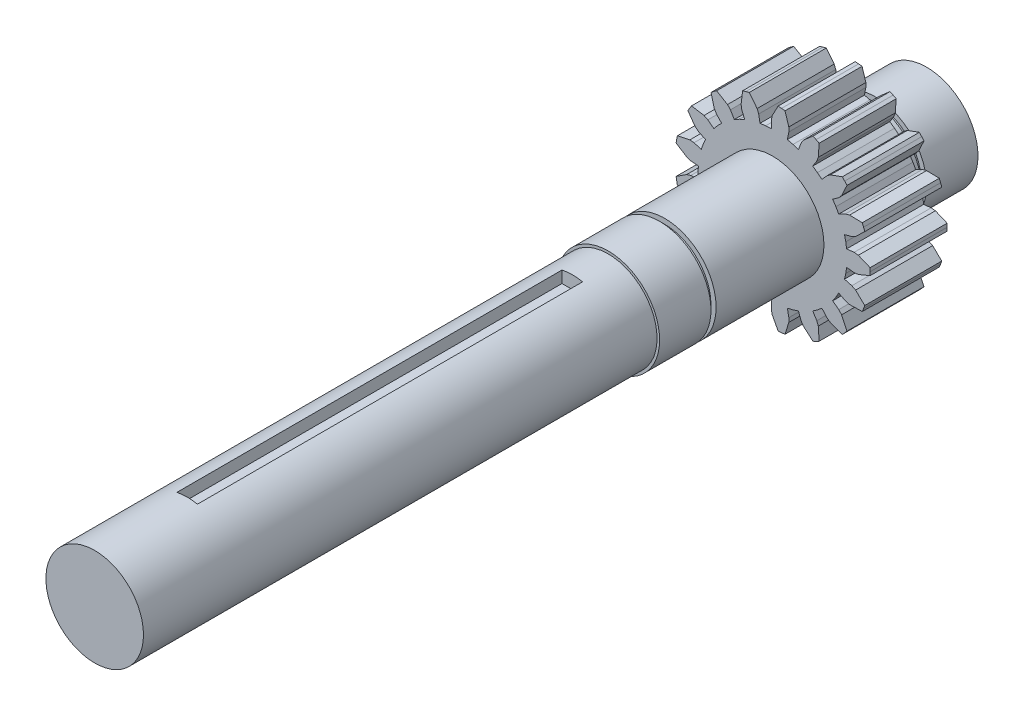
from build123d import *

# Parameters (mm, degrees)
GEAR_A_17T_INVOLUTE_DEPTH = 15
SKETCH2_R                 = 10
LEFT_STUB_D20X15_DEPTH    = 15
RIGHT_SHAFT_D20X32_START  = 32
SKETCH3_R                 = 10
RIGHT_SHAFT_D20X32_DEPTH  = 32
SKETCH4_R                 = 9.5
INPUT_SHAFT_D19X100_DEPTH = 100
SKETCH5_W                 = 75
SKETCH5_H                 = 4
KEYWAY_SLOT_75X4MM_DEPTH  = 2
SKETCH6_W                 = 1
SKETCH6_H                 = 2
SKETCH7_W                 = 1
SKETCH7_H                 = 2


with BuildPart() as part:
    # Sketch1 → Gear_A_17T_Involute (new body)
    with BuildSketch(Plane.XY):
        Polygon((14.41660223, -1.552926312), (15.882894514, -1.710872257), (16.703678506, -1.62240281), (18.988043831, -0.673937289), (19, 0), (18.988043831, 0.673937289), (16.703678506, 1.62240281), (15.882894514, 1.710872257), (14.41660223, 1.552926312), (14.253109945, 2.664368008), (14.004062911, 3.759816751), (15.428396402, 4.142222411), (16.16179583, 4.52121909), (17.949277792, 6.230844785), (17.716972359, 6.863591658), (17.462369334, 7.487700397), (14.989636842, 7.54691022), (14.192319712, 7.332904146), (12.882099534, 6.65593807), (12.328148468, 7.633266362), (11.700197295, 8.564775727), (12.890207864, 9.435886989), (13.437173072, 10.054225299), (14.486362327, 12.294116744), (14.041169427, 12.800217229), (13.578305096, 13.290208076), (11.251161661, 12.452165587), (10.584993491, 11.964586697), (9.607797913, 10.860028511), (8.738202227, 11.571249796), (7.816155202, 12.213014282), (8.611125326, 13.455182743), (8.897785632, 14.229352669), (9.066983358, 16.697000113), (8.46902876, 17.008102536), (7.860415515, 17.297799511), (5.993154754, 15.67568699), (5.548105245, 14.980385516), (5.035909946, 13.597411924), (3.968113356, 13.946471826), (2.876498039, 14.211817584), (3.169062598, 15.65728151), (3.156702938, 16.482727113), (2.423058045, 18.844861096), (1.75309883, 18.91894935), (1.080933263, 18.969227272), (-0.074260913, 16.782120004), (-0.238085357, 15.973000263), (-0.216105565, 14.49838951), (-1.337891212, 14.438145556), (-2.451646125, 14.29123617), (-2.700999595, 15.744777649), (-3.010709979, 16.510017927), (-4.548114684, 18.447619164), (-5.199596811, 18.27468722), (-5.844535016, 18.078755777), (-6.131647231, 15.622034719), (-5.992121213, 14.808372814), (-5.438934822, 13.441279255), (-6.463206159, 12.979867725), (-7.448681894, 12.440544122), (-8.206276826, 13.705854322), (-8.771509831, 14.307539335), (-10.905039323, 15.558924042), (-11.450058091, 15.162327318), (-11.980666456, 14.746648137), (-11.360920615, 12.35210708), (-10.936887895, 11.643792561), (-9.927205792, 10.568849756), (-10.7156293, 9.768586833), (-11.439731898, 8.909687654), (-12.603250898, 9.815879422), (-13.347668676, 10.172748274), (-15.789177975, 10.568910014), (-16.154125579, 10.002211095), (-16.498742504, 9.422923952), (-15.055838716, 7.413958934), (-14.404567264, 6.906653602), (-13.074752612, 6.269038533), (-13.520847326, 5.23800416), (-13.88578272, 4.175528498), (-15.2980861, 4.600215614), (-16.121150904, 4.66407119), (-18.54090065, 4.151506124), (-18.676488894, 3.491240839), (-18.788571953, 2.826581673), (-16.717382372, 1.474514552), (-15.926830005, 1.236732803), (-14.456481642, 1.122558918), (-14.5, 0), (-14.456481642, -1.122558918), (-15.926830005, -1.236732803), (-16.717382372, -1.474514552), (-18.788571953, -2.826581673), (-18.676488894, -3.491240839), (-18.54090065, -4.151506124), (-16.121150904, -4.66407119), (-15.2980861, -4.600215614), (-13.88578272, -4.175528498), (-13.520847326, -5.23800416), (-13.074752612, -6.269038533), (-14.404567264, -6.906653602), (-15.055838716, -7.413958934), (-16.498742504, -9.422923952), (-16.154125579, -10.002211095), (-15.789177975, -10.568910014), (-13.347668676, -10.172748274), (-12.603250898, -9.815879422), (-11.439731898, -8.909687654), (-10.7156293, -9.768586833), (-9.927205792, -10.568849756), (-10.936887895, -11.643792561), (-11.360920615, -12.35210708), (-11.980666456, -14.746648137), (-11.450058091, -15.162327318), (-10.905039323, -15.558924042), (-8.771509831, -14.307539335), (-8.206276826, -13.705854322), (-7.448681894, -12.440544122), (-6.463206159, -12.979867725), (-5.438934822, -13.441279255), (-5.992121213, -14.808372814), (-6.131647231, -15.622034719), (-5.844535016, -18.078755777), (-5.199596811, -18.27468722), (-4.548114684, -18.447619164), (-3.010709979, -16.510017927), (-2.700999595, -15.744777649), (-2.451646125, -14.29123617), (-1.337891212, -14.438145556), (-0.216105565, -14.49838951), (-0.238085357, -15.973000263), (-0.074260913, -16.782120004), (1.080933263, -18.969227272), (1.75309883, -18.91894935), (2.423058045, -18.844861096), (3.156702938, -16.482727113), (3.169062598, -15.65728151), (2.876498039, -14.211817584), (3.968113356, -13.946471826), (5.035909946, -13.597411924), (5.548105245, -14.980385516), (5.993154754, -15.67568699), (7.860415515, -17.297799511), (8.46902876, -17.008102536), (9.066983358, -16.697000113), (8.897785632, -14.229352669), (8.611125326, -13.455182743), (7.816155202, -12.213014282), (8.738202227, -11.571249796), (9.607797913, -10.860028511), (10.584993491, -11.964586697), (11.251161661, -12.452165587), (13.578305096, -13.290208076), (14.041169427, -12.800217229), (14.486362327, -12.294116744), (13.437173072, -10.054225299), (12.890207864, -9.435886989), (11.700197295, -8.564775727), (12.328148468, -7.633266362), (12.882099534, -6.65593807), (14.192319712, -7.332904146), (14.989636842, -7.54691022), (17.462369334, -7.487700397), (17.716972359, -6.863591658), (17.949277792, -6.230844785), (16.16179583, -4.52121909), (15.428396402, -4.142222411), (14.004062911, -3.759816751), (14.253109945, -2.664368008), align=None)
    extrude(amount=GEAR_A_17T_INVOLUTE_DEPTH)

    # Sketch2 → Left_Stub_D20x15 (add)
    with BuildSketch(Plane.XY):
        Circle(SKETCH2_R)
    extrude(amount=-LEFT_STUB_D20X15_DEPTH)

    # Sketch3 → Right_Shaft_D20x32 (add)
    with BuildSketch(Plane.XY.offset(15).offset(RIGHT_SHAFT_D20X32_START)):
        Circle(SKETCH3_R)
    extrude(amount=-RIGHT_SHAFT_D20X32_DEPTH)

    # Sketch4 → Input_Shaft_D19x100 (add)
    with BuildSketch(Plane.XY.offset(47)):
        Circle(SKETCH4_R)
    extrude(amount=INPUT_SHAFT_D19X100_DEPTH)

    # Sketch5 → Keyway_Slot_75x4mm (cut, symmetric)
    with BuildSketch(Plane(origin=(0, 0, 0), x_dir=(0, 0, -1), z_dir=(1, 0, 0))):
        with Locations((-91.5, 9)):
            Rectangle(SKETCH5_W, SKETCH5_H)
    extrude(amount=KEYWAY_SLOT_75X4MM_DEPTH, both=True, mode=Mode.SUBTRACT)

    # Sketch6 → Left_SnapRing_Groove_D18 (revolve, cut)
    with BuildSketch(Plane(origin=(0, 0, 0), x_dir=(0, 0, -1), z_dir=(1, 0, 0)), mode=Mode.PRIVATE) as left_snapring_groove_d18_sk:
        with Locations((4.5, 10)):
            Rectangle(SKETCH6_W, SKETCH6_H)
    revolve(left_snapring_groove_d18_sk.sketch.rotate(Axis((0, 0, 50), (0, 0, -1)), 90), axis=Axis((0, 0, 50), (0, 0, -1)), mode=Mode.SUBTRACT)

    # Sketch7 → Right_SnapRing_Groove_D18 (revolve, cut)
    with BuildSketch(Plane(origin=(0, 0, 0), x_dir=(0, 0, -1), z_dir=(1, 0, 0)), mode=Mode.PRIVATE) as right_snapring_groove_d18_sk:
        with Locations((-36.5, 10)):
            Rectangle(SKETCH7_W, SKETCH7_H)
    revolve(right_snapring_groove_d18_sk.sketch.rotate(Axis((0, 0, 50), (0, 0, -1)), 90), axis=Axis((0, 0, 50), (0, 0, -1)), mode=Mode.SUBTRACT)


solid = part.part
